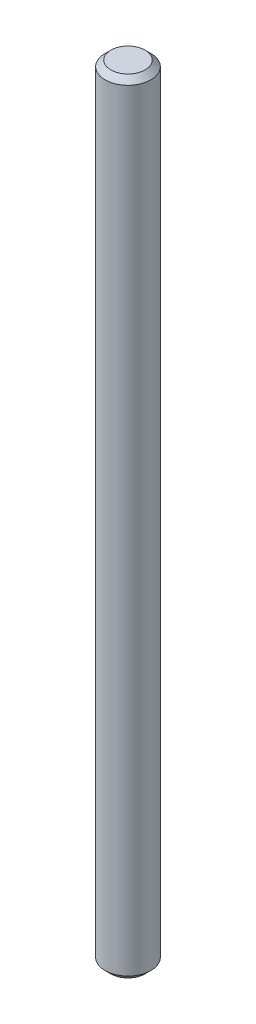
from build123d import *

# Parameters (mm, degrees)
SKETCH1_R           = 3.175
BOSS_EXTRUDE1_DEPTH = 108.585
CHAMFER1_SIZE       = 0.79375


with BuildPart() as part:
    # Sketch1 → Boss-Extrude1 (new body)
    with BuildSketch(Plane(origin=(0, 0, 0), x_dir=(1, 0, 0), z_dir=(0, 1, 0))):
        with Locations(Location((0, 0, 0), (0, 0, 270))):
            Circle(SKETCH1_R)
    extrude(amount=BOSS_EXTRUDE1_DEPTH)

    # Chamfer1
    chamfer1_edges = [part.edges().sort_by_distance(p)[0] for p in [
        (0, 0, -3.175),
        (0, 108.585, -3.175),
    ]]
    chamfer(chamfer1_edges, length=CHAMFER1_SIZE)


solid = part.part
